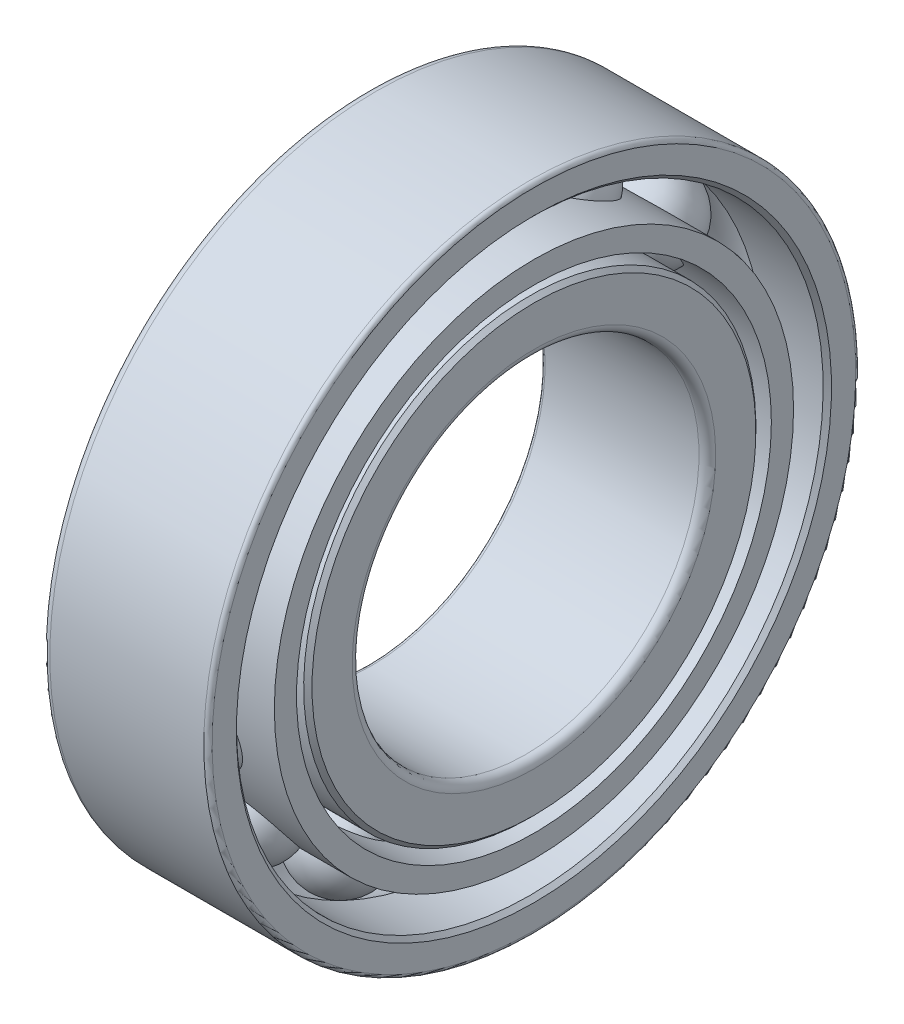
from build123d import *

# Parameters (mm, degrees)
CIRPATTERN1_COUNT        = 14
BOSS_EXTRUDE1_DEPTH      = 6
BOSS_EXTRUDE1_DEPTH_BACK = 6
SKETCH6_R                = 18.715
SKETCH6_R_2              = 17.115
CIRPATTERN2_COUNT        = 14
CHAMFER1_SIZE            = 0.3
CHAMFER2_SIZE            = 0.3


with BuildPart() as part:
    # Sketch3 → Revolve1 (revolve)
    with BuildSketch(Plane.XY, mode=Mode.PRIVATE) as revolve1_sk:
        with BuildLine():
            Line((5.7, 23.5), (-5.4, 23.5))
            ThreePointArc((-5.4, 23.5), (-5.824264069, 23.324264069), (-6, 22.9))
            Line((-6, 22.9), (-6, 19.7))
            Line((-6, 19.7), (-2.829810709, 19.7))
            ThreePointArc((-2.829810709, 19.7), (-1.66360517, 20.97715623), (0, 21.45))
            ThreePointArc((0, 21.45), (0.688797979, 21.374089068), (1.344533609, 21.15))
            Line((1.344533609, 21.15), (6, 21.15))
            Line((6, 21.15), (6, 23.2))
            ThreePointArc((6, 23.2), (5.912132034, 23.412132034), (5.7, 23.5))
        make_face()
        with BuildLine():
            Line((5.4, 12.5), (-5.7, 12.5))
            ThreePointArc((-5.7, 12.5), (-5.912132034, 12.587867966), (-6, 12.8))
            Line((-6, 12.8), (-6, 15.45))
            Line((-6, 15.45), (-1.398360653, 15.45))
            ThreePointArc((-1.398360653, 15.45), (0.680336757, 15.198133096), (2.460872963, 16.3))
            Line((2.460872963, 16.3), (6, 16.3))
            Line((6, 16.3), (6, 13.1))
            ThreePointArc((6, 13.1), (5.824264069, 12.675735931), (5.4, 12.5))
        make_face()
    revolve(revolve1_sk.sketch.rotate(Axis((-6, 0, 0), (1, 0, 0)), 180), axis=Axis((-6, 0, 0), (1, 0, 0)))

    # Chamfer1
    chamfer1_edges = [part.edges().sort_by_distance(p)[0] for p in [
        (6, 21.15, 0),
        (-6, 19.7, 0),
    ]]
    chamfer(chamfer1_edges, length=CHAMFER1_SIZE)

    # Chamfer2
    chamfer2_edges = [part.edges().sort_by_distance(p)[0] for p in [
        (6, 16.3, 0),
        (-6, 15.45, 0),
    ]]
    chamfer(chamfer2_edges, length=CHAMFER2_SIZE)


with BuildPart() as body_2:
    # Sketch5 → Revolve2 (revolve)
    with BuildSketch(Plane.XY):
        with BuildLine():
            Line((0, 21.45), (0, 15.124097914))
            ThreePointArc((0, 15.124097914), (3.162951043, 18.287048957), (0, 21.45))
        make_face()
    revolve(axis=Axis((0, -23.5, 0), (0, 1, 0)))


with BuildPart() as cirpattern1_1:
    # CirPattern1: pattern copy
    add(body_2.part.rotate(Axis((0, 0, 0), (1, 0, 0)), 1 * 360 / CIRPATTERN1_COUNT))


with BuildPart() as cirpattern1_2:
    # CirPattern1: pattern copy
    add(body_2.part.rotate(Axis((0, 0, 0), (1, 0, 0)), 2 * 360 / CIRPATTERN1_COUNT))


with BuildPart() as cirpattern1_3:
    # CirPattern1: pattern copy
    add(body_2.part.rotate(Axis((0, 0, 0), (1, 0, 0)), 3 * 360 / CIRPATTERN1_COUNT))


with BuildPart() as cirpattern1_4:
    # CirPattern1: pattern copy
    add(body_2.part.rotate(Axis((0, 0, 0), (1, 0, 0)), 4 * 360 / CIRPATTERN1_COUNT))


with BuildPart() as cirpattern1_5:
    # CirPattern1: pattern copy
    add(body_2.part.rotate(Axis((0, 0, 0), (1, 0, 0)), 5 * 360 / CIRPATTERN1_COUNT))


with BuildPart() as cirpattern1_6:
    # CirPattern1: pattern copy
    add(body_2.part.rotate(Axis((0, 0, 0), (1, 0, 0)), 6 * 360 / CIRPATTERN1_COUNT))


with BuildPart() as cirpattern1_7:
    # CirPattern1: pattern copy
    add(body_2.part.rotate(Axis((0, 0, 0), (1, 0, 0)), 7 * 360 / CIRPATTERN1_COUNT))


with BuildPart() as cirpattern1_8:
    # CirPattern1: pattern copy
    add(body_2.part.rotate(Axis((0, 0, 0), (1, 0, 0)), 8 * 360 / CIRPATTERN1_COUNT))


with BuildPart() as cirpattern1_9:
    # CirPattern1: pattern copy
    add(body_2.part.rotate(Axis((0, 0, 0), (1, 0, 0)), 9 * 360 / CIRPATTERN1_COUNT))


with BuildPart() as cirpattern1_10:
    # CirPattern1: pattern copy
    add(body_2.part.rotate(Axis((0, 0, 0), (1, 0, 0)), 10 * 360 / CIRPATTERN1_COUNT))


with BuildPart() as cirpattern1_11:
    # CirPattern1: pattern copy
    add(body_2.part.rotate(Axis((0, 0, 0), (1, 0, 0)), 11 * 360 / CIRPATTERN1_COUNT))


with BuildPart() as cirpattern1_12:
    # CirPattern1: pattern copy
    add(body_2.part.rotate(Axis((0, 0, 0), (1, 0, 0)), 12 * 360 / CIRPATTERN1_COUNT))


with BuildPart() as cirpattern1_13:
    # CirPattern1: pattern copy
    add(body_2.part.rotate(Axis((0, 0, 0), (1, 0, 0)), 13 * 360 / CIRPATTERN1_COUNT))


with BuildPart() as body_16:
    # Sketch6 → Boss-Extrude1 (new, two sides: drawn at the far end of the back side and taken through both)
    with BuildSketch(Plane(origin=(0, 0, 0), x_dir=(0, 0, -1), z_dir=(1, 0, 0)).offset(-BOSS_EXTRUDE1_DEPTH_BACK)):
        Circle(SKETCH6_R)
        Circle(SKETCH6_R_2, mode=Mode.SUBTRACT)
    extrude(amount=BOSS_EXTRUDE1_DEPTH + BOSS_EXTRUDE1_DEPTH_BACK)

    # Sketch8 → Cut-Revolve1 (revolve, cut)
    with BuildSketch(Plane.XY):
        with BuildLine():
            Line((0, 15.114097914), (0, 21.46))
            ThreePointArc((0, 21.46), (3.172951043, 18.287048957), (0, 15.114097914))
        make_face()
    cut_revolve1 = revolve(axis=Axis((0, -23.5, 0), (0, 1, 0)), mode=Mode.SUBTRACT)

    # CirPattern2: Cut-Revolve1 ×14 about axis
    cirpattern2_axis = Axis((0, 0, 0), (1, 0, 0))
    for i in range(1, CIRPATTERN2_COUNT):
        add(cut_revolve1.rotate(cirpattern2_axis, i * 360 / CIRPATTERN2_COUNT), mode=Mode.SUBTRACT)


solid = Compound([part.part, body_2.part, cirpattern1_1.part, cirpattern1_2.part, cirpattern1_3.part, cirpattern1_4.part, cirpattern1_5.part, cirpattern1_6.part, cirpattern1_7.part, cirpattern1_8.part, cirpattern1_9.part, cirpattern1_10.part, cirpattern1_11.part, cirpattern1_12.part, cirpattern1_13.part, body_16.part])
